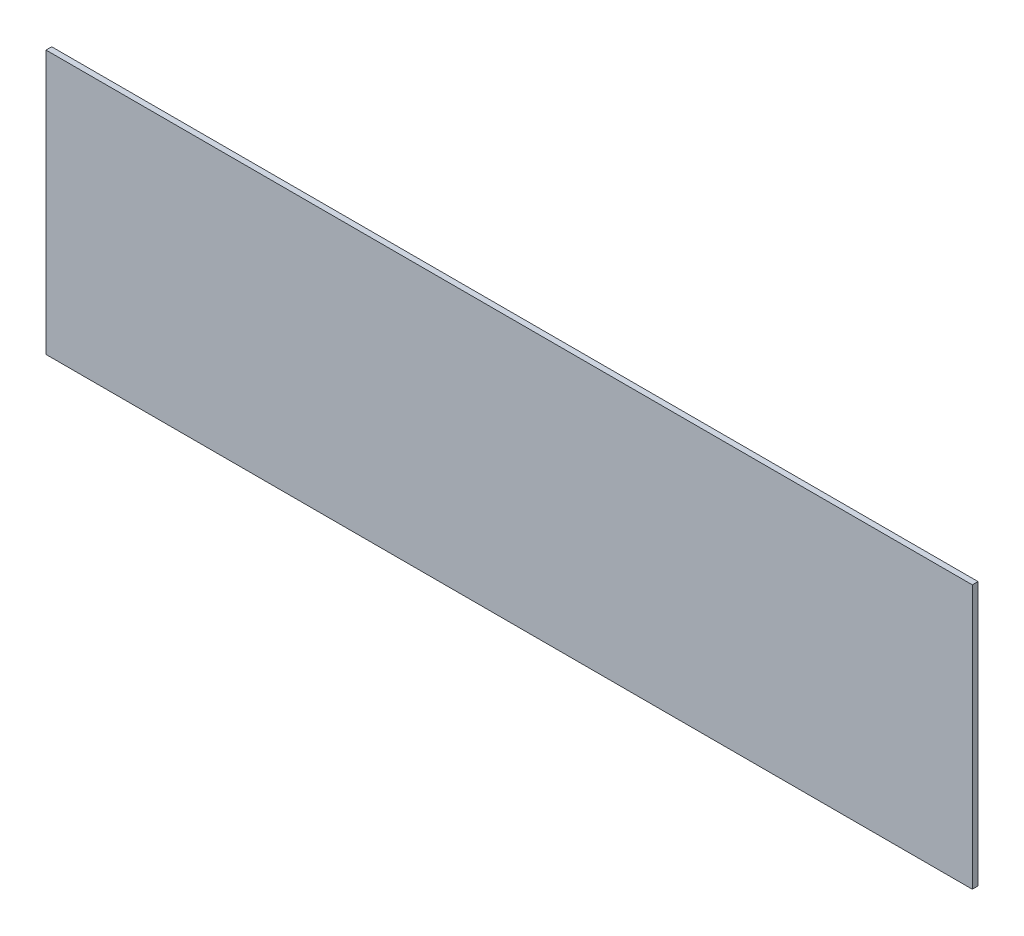
from build123d import *

# Parameters (mm, degrees)
SKETCH1_W           = 325
SKETCH1_H           = 92.5
BOSS_EXTRUDE1_DEPTH = 2


with BuildPart() as part:
    # Sketch1 → Boss-Extrude1 (new body)
    with BuildSketch(Plane.XY):
        Rectangle(SKETCH1_W, SKETCH1_H)
    extrude(amount=BOSS_EXTRUDE1_DEPTH)


solid = part.part
